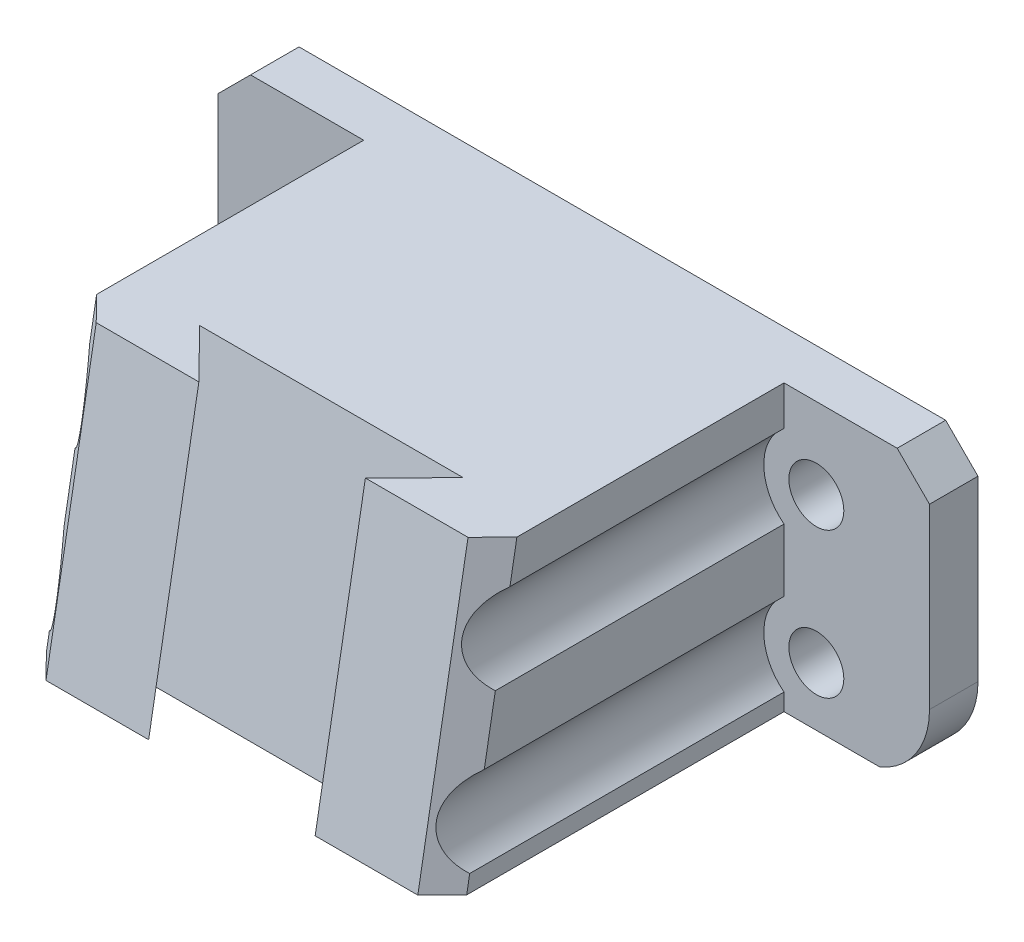
from build123d import *

# Parameters (mm, degrees)
BOSS_EXTRUDE1_DEPTH             = 3
M3_CLEARANCE_HOLE1_D            = 3.4
BOSS_EXTRUDE3_DEPTH             = 13
BOSS_EXTRUDE3_DEPTH_BACK        = 13
BOSS_EXTRUDE4_REACH             = 52.335
BOSS_EXTRUDE4_DIRECTION_2_REACH = 52.335
CUT_EXTRUDE1_REACH              = 52.395
SKETCH7_R                       = 3.25


with BuildPart() as part:
    # Sketch1 → Boss-Extrude1 (new body)
    with BuildSketch(Plane.XY):
        with BuildLine():
            Line((-40.923076923, -5.115384615), (-3.076923077, -5.115384615))
            ThreePointArc((-3.076923077, -5.115384615), (-0.839748528, -3.273500981), (0, -0.5))
            Line((0, -0.5), (0, 10.5))
            Line((0, 10.5), (-2, 12.5))
            Line((-2, 12.5), (-42, 12.5))
            Line((-42, 12.5), (-44, 10.5))
            Line((-44, 10.5), (-44, -0.5))
            ThreePointArc((-44, -0.5), (-43.160251472, -3.273500981), (-40.923076923, -5.115384615))
        make_face()
    extrude(amount=BOSS_EXTRUDE1_DEPTH)

    # M3 Clearance Hole1 (through all)
    with Locations(Plane.XY.offset(3)):
        with Locations((-37, 7.5), (-37, -1.5), (-7, 7.5), (-7, -1.5)):
            Hole(M3_CLEARANCE_HOLE1_D / 2)

    # Sketch5 → Boss-Extrude3 (add, two sides: drawn at the far end of the back side and taken through both)
    with BuildSketch(Plane(origin=(-22, 0, 0), x_dir=(0, 0, -1), z_dir=(1, 0, 0)).offset(-BOSS_EXTRUDE3_DEPTH_BACK)):
        Polygon((-18, 12.5), (-21.106067583, -5.115384615), (-3, -5.115384615), (-3, 12.5), align=None)
    extrude(amount=BOSS_EXTRUDE3_DEPTH + BOSS_EXTRUDE3_DEPTH_BACK)

    # Boss-Extrude4: up to this plane
    boss_extrude4_end = Plane(origin=(-40.923076923, -5.115384615, 3), z_dir=(0, 1, 0))
    # Sketch6 → Boss-Extrude4 (add, up to the surface)
    with BuildSketch(Plane(origin=(0, 0.237205282, -0.041825691), x_dir=(1, 0, 0), z_dir=(0, 0.9848077530122074, -0.17364817766693444)), mode=Mode.PRIVATE) as boss_extrude4_sk1:
        Polygon((-35, -19.897141775), (-35, -21.397141775), (-33.5, -22.897141775), (-27.15, -22.897141775), (-30.15, -19.897141775), align=None)
    boss_extrude4_tool1 = split(extrude(boss_extrude4_sk1.sketch, amount=-BOSS_EXTRUDE4_REACH, mode=Mode.PRIVATE), bisect_by=boss_extrude4_end, keep=Keep.BOTH, mode=Mode.PRIVATE)
    add(boss_extrude4_tool1.solids().sort_by_distance((-31.594351, 3.963678, 21.092053))[0])
    # Sketch6 → Boss-Extrude4 (add, up to the surface)
    with BuildSketch(Plane(origin=(0, 0.237205282, -0.041825691), x_dir=(1, 0, 0), z_dir=(0, 0.9848077530122074, -0.17364817766693444)), mode=Mode.PRIVATE) as boss_extrude4_sk2:
        Polygon((-13.85, -19.897141775), (-16.85, -22.897141775), (-10.5, -22.897141775), (-9, -21.397141775), (-9, -19.897141775), align=None)
    boss_extrude4_tool2 = split(extrude(boss_extrude4_sk2.sketch, amount=-BOSS_EXTRUDE4_REACH, mode=Mode.PRIVATE), bisect_by=boss_extrude4_end, keep=Keep.BOTH, mode=Mode.PRIVATE)
    add(boss_extrude4_tool2.solids().sort_by_distance((-12.405649, 3.963678, 21.092053))[0])

    # Boss-Extrude4 direction 2: up to this plane
    boss_extrude4_direction_2_end = Plane(origin=(-2, 12.5, 3), z_dir=(0, -1, 0))
    # Sketch6 → Boss-Extrude4 direction 2 (add, up to the surface)
    with BuildSketch(Plane(origin=(0, 0.237205282, -0.041825691), x_dir=(1, 0, 0), z_dir=(0, 0.9848077530122074, -0.17364817766693444)), mode=Mode.PRIVATE) as boss_extrude4_direction_2_sk1:
        Polygon((-35, -19.897141775), (-35, -21.397141775), (-33.5, -22.897141775), (-27.15, -22.897141775), (-30.15, -19.897141775), align=None)
    boss_extrude4_direction_2_tool1 = split(extrude(boss_extrude4_direction_2_sk1.sketch, amount=BOSS_EXTRUDE4_DIRECTION_2_REACH, mode=Mode.PRIVATE), bisect_by=boss_extrude4_direction_2_end, keep=Keep.BOTH, mode=Mode.PRIVATE)
    add(boss_extrude4_direction_2_tool1.solids().sort_by_distance((-31.594351, 3.963678, 21.092053))[0])
    # Sketch6 → Boss-Extrude4 direction 2 (add, up to the surface)
    with BuildSketch(Plane(origin=(0, 0.237205282, -0.041825691), x_dir=(1, 0, 0), z_dir=(0, 0.9848077530122074, -0.17364817766693444)), mode=Mode.PRIVATE) as boss_extrude4_direction_2_sk2:
        Polygon((-13.85, -19.897141775), (-16.85, -22.897141775), (-10.5, -22.897141775), (-9, -21.397141775), (-9, -19.897141775), align=None)
    boss_extrude4_direction_2_tool2 = split(extrude(boss_extrude4_direction_2_sk2.sketch, amount=BOSS_EXTRUDE4_DIRECTION_2_REACH, mode=Mode.PRIVATE), bisect_by=boss_extrude4_direction_2_end, keep=Keep.BOTH, mode=Mode.PRIVATE)
    add(boss_extrude4_direction_2_tool2.solids().sort_by_distance((-12.405649, 3.963678, 21.092053))[0])

    # Sketch7 → Cut-Extrude1 (cut, up to next)
    with BuildSketch(Plane.XY.offset(3), mode=Mode.PRIVATE) as cut_extrude1_sk1:
        with Locations((-37, 7.5)):
            Circle(SKETCH7_R)
    cut_extrude1_tool1 = extrude(cut_extrude1_sk1.sketch, amount=CUT_EXTRUDE1_REACH, mode=Mode.PRIVATE) & part.part
    # Sketch7 → Cut-Extrude1 (cut, up to next)
    with BuildSketch(Plane.XY.offset(3), mode=Mode.PRIVATE) as cut_extrude1_sk2:
        with Locations((-37, -1.5)):
            Circle(SKETCH7_R)
    cut_extrude1_tool2 = extrude(cut_extrude1_sk2.sketch, amount=CUT_EXTRUDE1_REACH, mode=Mode.PRIVATE) & part.part
    # Sketch7 → Cut-Extrude1 (cut, up to next)
    with BuildSketch(Plane.XY.offset(3), mode=Mode.PRIVATE) as cut_extrude1_sk3:
        with Locations((-7, -1.5)):
            Circle(SKETCH7_R)
    cut_extrude1_tool3 = extrude(cut_extrude1_sk3.sketch, amount=CUT_EXTRUDE1_REACH, mode=Mode.PRIVATE) & part.part
    # Sketch7 → Cut-Extrude1 (cut, up to next)
    with BuildSketch(Plane.XY.offset(3), mode=Mode.PRIVATE) as cut_extrude1_sk4:
        with Locations((-7, 7.5)):
            Circle(SKETCH7_R)
    cut_extrude1_tool4 = extrude(cut_extrude1_sk4.sketch, amount=CUT_EXTRUDE1_REACH, mode=Mode.PRIVATE) & part.part
    add(cut_extrude1_tool1.solids().sort_by_distance((-37, 7.5, 3))[0], mode=Mode.SUBTRACT)
    add(cut_extrude1_tool2.solids().sort_by_distance((-37, -1.5, 3))[0], mode=Mode.SUBTRACT)
    add(cut_extrude1_tool3.solids().sort_by_distance((-7, -1.5, 3))[0], mode=Mode.SUBTRACT)
    add(cut_extrude1_tool4.solids().sort_by_distance((-7, 7.5, 3))[0], mode=Mode.SUBTRACT)


solid = part.part
